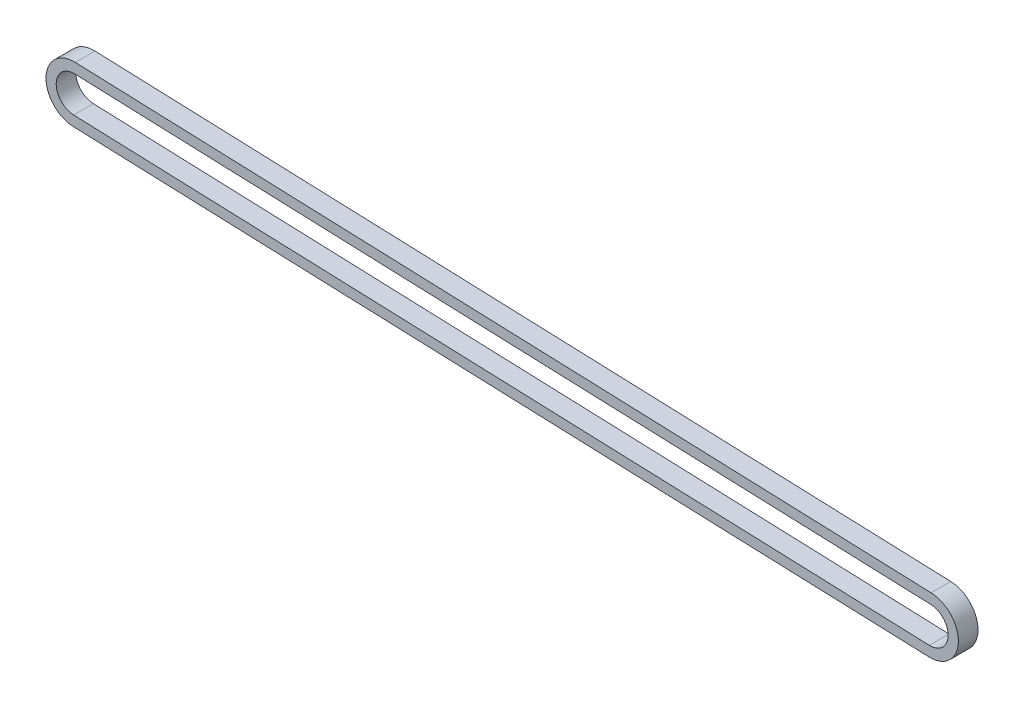
from build123d import *

# Parameters (mm, degrees)
BOSS_EXTRUDE1_DEPTH = 3.175


with BuildPart() as part:
    # Sketch1 → Boss-Extrude1 (new body)
    with BuildSketch(Plane.XY):
        with BuildLine():
            Line((0.167974753, 4.568913271), (-138.008025247, 9.648913271))
            ThreePointArc((-138.008025247, 9.648913271), (-142.744913271, 5.247974753), (-138.343974753, 0.511086729))
            Line((-138.343974753, 0.511086729), (-0.167974753, -4.568913271))
            ThreePointArc((-0.167974753, -4.568913271), (4.568913271, -0.167974753), (0.167974753, 4.568913271))
        make_face()
        with BuildLine():
            Line((-138.283317203, 2.160972077), (-0.107317203, -2.919027923))
            ThreePointArc((-0.107317203, -2.919027923), (2.919027923, -0.107317203), (0.107317203, 2.919027923))
            Line((0.107317203, 2.919027923), (-138.068682797, 7.999027923))
            ThreePointArc((-138.068682797, 7.999027923), (-141.095027923, 5.187317203), (-138.283317203, 2.160972077))
        make_face(mode=Mode.SUBTRACT)
    extrude(amount=BOSS_EXTRUDE1_DEPTH)


solid = part.part
